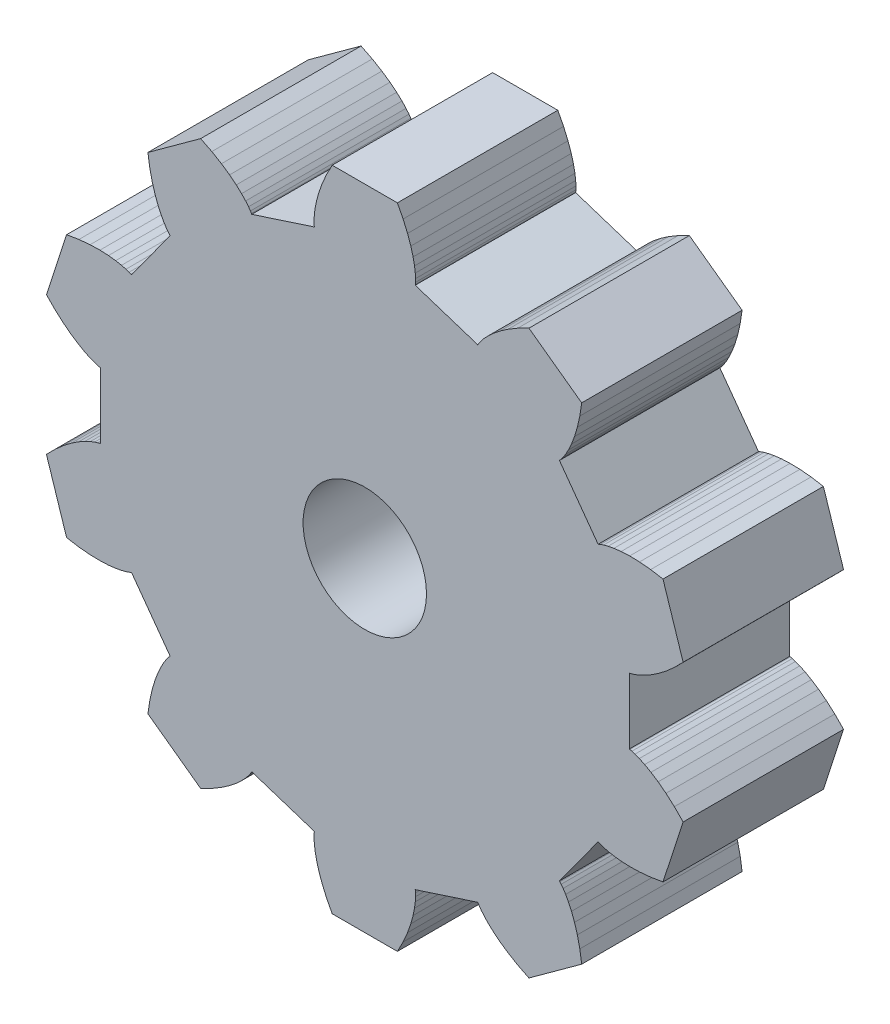
from build123d import *

# Parameters (mm, degrees)
BOSS_EXTRUDE1_DEPTH = 6.5
CUT_EXTRUDE1_REACH  = 21.523
SKETCH1_R           = 2.5


with BuildPart() as part:
    # Model → Boss-Extrude1 (new body)
    with BuildSketch(Plane.XY):
        Polygon((10.717363759, -1.333459435), (10.717363759, 1.333459435), (10.743639552, 1.337986987), (10.821460567, 1.356462749), (10.948741432, 1.396087766), (11.122644802, 1.463821237), (11.339606269, 1.566310843), (11.595365319, 1.709825467), (11.885002099, 1.900190808), (12.202979765, 2.14272837), (12.543192079, 2.442198287), (12.899015952, 2.802746419), (12.082936127, 5.314381861), (11.583143692, 5.396923403), (11.131882147, 5.439227874), (10.73207281, 5.448542301), (10.385857792, 5.432306869), (10.094588596, 5.398081241), (9.858821202, 5.353470323), (9.678317686, 5.306050017), (9.552054302, 5.263293514), (9.478235998, 5.232498674), (9.454317206, 5.220717017), (7.886741625, 7.378299705), (7.90533796, 7.397407095), (7.957436704, 7.458096346), (8.037118086, 7.564967473), (8.137996132, 7.721982839), (8.253279767, 7.932425423), (8.375837405, 8.19886259), (8.498264543, 8.523115614), (8.612953876, 8.906235205), (8.712167419, 9.348483239), (8.788110104, 9.849320829), (6.651585385, 11.4015969), (6.198728111, 11.174603788), (5.808783908, 10.943583943), (5.479856477, 10.71611744), (5.209305592, 10.499482619), (4.993781181, 10.300589766), (4.829262993, 10.125918178), (4.711105537, 9.981457039), (4.634087956, 9.872650547), (4.592468446, 9.804347687), (4.580042821, 9.780757014), (2.043652252, 10.604880267), (2.04746596, 10.631269122), (2.053942483, 10.71099063), (2.055588802, 10.84428673), (2.04490954, 11.030609456), (2.014480913, 11.268623104), (1.957024287, 11.556212872), (1.865478777, 11.890499945), (1.73307235, 12.267862904), (1.553390921, 12.683965336), (1.320444894, 13.133789449), (-1.320444894, 13.133789449), (-1.553390921, 12.683965336), (-1.73307235, 12.267862904), (-1.865478777, 11.890499945), (-1.957024287, 11.556212872), (-2.014480913, 11.268623104), (-2.04490954, 11.030609456), (-2.055588802, 10.84428673), (-2.053942483, 10.71099063), (-2.04746596, 10.631269122), (-2.043652252, 10.604880267), (-4.580042821, 9.780757014), (-4.592468446, 9.804347687), (-4.634087956, 9.872650547), (-4.711105537, 9.981457039), (-4.829262993, 10.125918178), (-4.993781181, 10.300589766), (-5.209305592, 10.499482619), (-5.479856477, 10.71611744), (-5.808783908, 10.943583943), (-6.198728111, 11.174603788), (-6.651585385, 11.4015969), (-8.788110104, 9.849320829), (-8.712167419, 9.348483239), (-8.612953876, 8.906235205), (-8.498264543, 8.523115614), (-8.375837405, 8.19886259), (-8.253279767, 7.932425423), (-8.137996132, 7.721982839), (-8.037118086, 7.564967473), (-7.957436704, 7.458096346), (-7.90533796, 7.397407095), (-7.886741625, 7.378299705), (-9.454317206, 5.220717017), (-9.478235998, 5.232498674), (-9.552054302, 5.263293514), (-9.678317686, 5.306050017), (-9.858821202, 5.353470323), (-10.094588596, 5.398081241), (-10.385857792, 5.432306869), (-10.73207281, 5.448542301), (-11.131882147, 5.439227874), (-11.583143692, 5.396923403), (-12.082936127, 5.314381861), (-12.899015952, 2.802746419), (-12.543192079, 2.442198287), (-12.202979765, 2.14272837), (-11.885002099, 1.900190808), (-11.595365319, 1.709825467), (-11.339606269, 1.566310843), (-11.122644802, 1.463821237), (-10.948741432, 1.396087766), (-10.821460567, 1.356462749), (-10.743639552, 1.337986987), (-10.717363759, 1.333459435), (-10.717363759, -1.333459435), (-10.743639552, -1.337986987), (-10.821460567, -1.356462749), (-10.948741432, -1.396087766), (-11.122644802, -1.463821237), (-11.339606269, -1.566310843), (-11.595365319, -1.709825467), (-11.885002099, -1.900190808), (-12.202979765, -2.14272837), (-12.543192079, -2.442198287), (-12.899015952, -2.802746419), (-12.082936127, -5.314381861), (-11.583143692, -5.396923403), (-11.131882147, -5.439227874), (-10.73207281, -5.448542301), (-10.385857792, -5.432306869), (-10.094588596, -5.398081241), (-9.858821202, -5.353470323), (-9.678317686, -5.306050017), (-9.552054302, -5.263293514), (-9.478235998, -5.232498674), (-9.454317206, -5.220717017), (-7.886741625, -7.378299705), (-7.90533796, -7.397407095), (-7.957436704, -7.458096346), (-8.037118086, -7.564967473), (-8.137996132, -7.721982839), (-8.253279767, -7.932425423), (-8.375837405, -8.19886259), (-8.498264543, -8.523115614), (-8.612953876, -8.906235205), (-8.712167419, -9.348483239), (-8.788110104, -9.849320829), (-6.651585385, -11.4015969), (-6.198728111, -11.174603788), (-5.808783908, -10.943583943), (-5.479856477, -10.71611744), (-5.209305592, -10.499482619), (-4.993781181, -10.300589766), (-4.829262993, -10.125918178), (-4.711105537, -9.981457039), (-4.634087956, -9.872650547), (-4.592468446, -9.804347687), (-4.580042821, -9.780757014), (-2.043652252, -10.604880267), (-2.04746596, -10.631269122), (-2.053942483, -10.71099063), (-2.055588802, -10.84428673), (-2.04490954, -11.030609456), (-2.014480913, -11.268623104), (-1.957024287, -11.556212872), (-1.865478777, -11.890499945), (-1.73307235, -12.267862904), (-1.553390921, -12.683965336), (-1.320444894, -13.133789449), (1.320444894, -13.133789449), (1.553390921, -12.683965336), (1.73307235, -12.267862904), (1.865478777, -11.890499945), (1.957024287, -11.556212872), (2.014480913, -11.268623104), (2.04490954, -11.030609456), (2.055588802, -10.84428673), (2.053942483, -10.71099063), (2.04746596, -10.631269122), (2.043652252, -10.604880267), (4.580042821, -9.780757014), (4.592468446, -9.804347687), (4.634087956, -9.872650547), (4.711105537, -9.981457039), (4.829262993, -10.125918178), (4.993781181, -10.300589766), (5.209305592, -10.499482619), (5.479856477, -10.71611744), (5.808783908, -10.943583943), (6.198728111, -11.174603788), (6.651585385, -11.4015969), (8.788110104, -9.849320829), (8.712167419, -9.348483239), (8.612953876, -8.906235205), (8.498264543, -8.523115614), (8.375837405, -8.19886259), (8.253279767, -7.932425423), (8.137996132, -7.721982839), (8.037118086, -7.564967473), (7.957436704, -7.458096346), (7.90533796, -7.397407095), (7.886741625, -7.378299705), (9.454317206, -5.220717017), (9.478235998, -5.232498674), (9.552054302, -5.263293514), (9.678317686, -5.306050017), (9.858821202, -5.353470323), (10.094588596, -5.398081241), (10.385857792, -5.432306869), (10.73207281, -5.448542301), (11.131882147, -5.439227874), (11.583143692, -5.396923403), (12.082936127, -5.314381861), (12.899015952, -2.802746419), (12.543192079, -2.442198287), (12.202979765, -2.14272837), (11.885002099, -1.900190808), (11.595365319, -1.709825467), (11.339606269, -1.566310843), (11.122644802, -1.463821237), (10.948741432, -1.396087766), (10.821460567, -1.356462749), (10.743639552, -1.337986987), align=None)
    extrude(amount=BOSS_EXTRUDE1_DEPTH)

    # Sketch1 → Cut-Extrude1 (cut, up to next)
    with BuildSketch(Plane.XY.offset(6.5), mode=Mode.PRIVATE) as cut_extrude1_sk1:
        Circle(SKETCH1_R)
    cut_extrude1_tool1 = extrude(cut_extrude1_sk1.sketch, amount=-CUT_EXTRUDE1_REACH, mode=Mode.PRIVATE) & part.part
    add(cut_extrude1_tool1.solids().sort_by_distance((0, 0, 6.5))[0], mode=Mode.SUBTRACT)


solid = part.part
